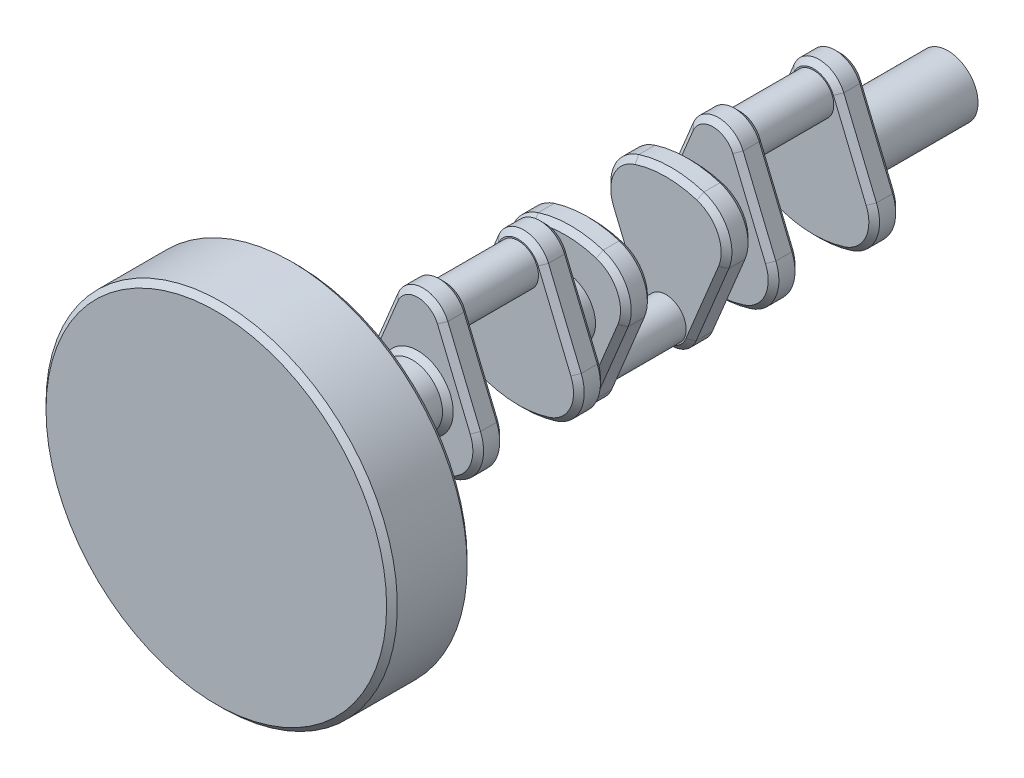
from build123d import *

# Parameters (mm, degrees)
SKETCH1_R             = 9.525
BOSS_EXTRUDE1_DEPTH   = 34.925
BOSS_EXTRUDE2_DEPTH   = 12.7
FILLET1_R             = 19.05
SKETCH3_R             = 14.2875
BOSS_EXTRUDE3_DEPTH   = 9.525
LPATTERN1_COUNT       = 3
LPATTERN1_PITCH       = 69.85
BODY_MOVE_COPY1_ANGLE = 180
LPATTERN2_COUNT       = 2
LPATTERN2_PITCH       = 69.85
SKETCH4_R             = 14.2875
BOSS_EXTRUDE4_DEPTH   = 57.15
BOSS_EXTRUDE5_START   = 50.8
SKETCH5_R             = 14.2875
BOSS_EXTRUDE5_DEPTH   = 50.8
SKETCH6_R             = 83.107085054
BOSS_EXTRUDE6_DEPTH   = 38.1
CHAMFER1_SIZE         = 2.54


with BuildPart() as part:
    # Sketch1 → Boss-Extrude1 (new body)
    with BuildSketch(Plane.XY):
        Circle(SKETCH1_R)
    extrude(amount=-BOSS_EXTRUDE1_DEPTH)

    # Sketch2 → Boss-Extrude2 (add)
    with BuildSketch(Plane(origin=(0, 0, -34.925), x_dir=(-1, 0, 0), z_dir=(0, 0, -1))):
        with BuildLine():
            Line((-11.733270063, 4.860079591), (-33.507418174, -47.707364088))
            ThreePointArc((-33.507418174, -47.707364088), (0, -60.325), (33.507418174, -47.707364088))
            Line((33.507418174, -47.707364088), (11.733270063, 4.860079591))
            ThreePointArc((11.733270063, 4.860079591), (0, 12.7), (-11.733270063, 4.860079591))
        make_face()
    extrude(amount=BOSS_EXTRUDE2_DEPTH)

    # Fillet1
    fillet1_edges = [part.edges().sort_by_distance(p)[0] for p in [
        (33.507418174, -47.707364088, -41.275),
        (-33.507418174, -47.707364088, -41.275),
    ]]
    fillet(fillet1_edges, radius=FILLET1_R)

    # Mirror2: part across plane


with BuildPart() as part_1:
    add(part.part)
    add(part.part.mirror(Plane.XY.offset(-17.4625)))


with BuildPart() as body_2:
    # Sketch3 → Boss-Extrude3 (new body)
    with BuildSketch(Plane(origin=(0, 0, -47.625), x_dir=(-1, 0, 0), z_dir=(0, 0, -1))):
        with Locations((0, -28.486474017)):
            Circle(SKETCH3_R)
    boss_extrude3 = extrude(amount=BOSS_EXTRUDE3_DEPTH)


with BuildPart() as lpattern1_1:
    # LPattern1: pattern copy
    add(part_1.part.moved(Location(Vector(0, 0, -1) * (1 * LPATTERN1_PITCH))))


with BuildPart() as lpattern1_2:
    # LPattern1: pattern copy
    add(part_1.part.moved(Location(Vector(0, 0, -1) * (2 * LPATTERN1_PITCH))))

    # Sketch5 → Boss-Extrude5 (add)
    with BuildSketch(Plane(origin=(0, 0, -187.325), x_dir=(-1, 0, 0), z_dir=(0, 0, -1)).offset(BOSS_EXTRUDE5_START)):
        with Locations((0, -28.486474017)):
            Circle(SKETCH5_R)
    extrude(amount=-BOSS_EXTRUDE5_DEPTH)


with BuildPart() as lpattern1_1_1:
    # Body-Move/Copy1: moved
    add(lpattern1_1.part.rotate(Axis((0, -28.486474017, 0), (0, 0, 1)), BODY_MOVE_COPY1_ANGLE))


with BuildPart() as lpattern2_1:
    # LPattern2: Boss-Extrude3 ×2
    with Locations(*[(0, 0, -i * LPATTERN2_PITCH) for i in range(1, LPATTERN2_COUNT)]):
        add(boss_extrude3)


with BuildPart() as part_2:
    add(part_1.part)

    # Sketch4 → Boss-Extrude4 (add)
    with BuildSketch(Plane.XY.offset(12.7)):
        with Locations((0, -28.486474017)):
            Circle(SKETCH4_R)
    extrude(amount=BOSS_EXTRUDE4_DEPTH)

    # Sketch6 → Boss-Extrude6 (add)
    with BuildSketch(Plane.XY.offset(69.85)):
        with Locations((0, -28.486474017)):
            Circle(SKETCH6_R)
    extrude(amount=BOSS_EXTRUDE6_DEPTH)


with BuildPart() as body_2_1:
    add(body_2.part)

    # Combine1: union LPattern1_1, LPattern2_1, LPattern1_2, part
    add(lpattern1_1_1.part)
    add(lpattern2_1.part)
    add(lpattern1_2.part)
    add(part_2.part)

    # Chamfer1
    chamfer1_edges = [body_2_1.edges().sort_by_distance(p)[0] for p in [
        (14.2875, -28.486474017, -187.325),
        (-14.2875, -28.486474017, 12.7),
        (-26.88006293, -47.820548612, -174.625),
        (-19.470080331, -13.818232688, -174.625),
        (0, -60.325, -174.625),
        (0, 12.7, -174.625),
        (26.88006293, -47.820548612, -174.625),
        (19.470080331, -13.818232688, -174.625),
        (-26.88006293, -47.820548612, -187.325),
        (-19.470080331, -13.818232688, -187.325),
        (0, -60.325, -187.325),
        (0, 12.7, -187.325),
        (26.88006293, -47.820548612, -187.325),
        (19.470080331, -13.818232688, -187.325),
        (-26.88006293, -47.820548612, -139.7),
        (-19.470080331, -13.818232688, -139.7),
        (0, -60.325, -139.7),
        (0, 12.7, -139.7),
        (26.88006293, -47.820548612, -139.7),
        (19.470080331, -13.818232688, -139.7),
        (-26.88006293, -47.820548612, -127),
        (-19.470080331, -13.818232688, -127),
        (0, -60.325, -127),
        (0, 12.7, -127),
        (26.88006293, -47.820548612, -127),
        (19.470080331, -13.818232688, -127),
        (-19.470080331, -43.154715345, -117.475),
        (-26.88006293, -9.152399421, -117.475),
        (0, -69.672948033, -117.475),
        (0, 3.352051967, -117.475),
        (19.470080331, -43.154715345, -117.475),
        (26.88006293, -9.152399421, -117.475),
        (-19.470080331, -43.154715345, -104.775),
        (0, -69.672948033, -104.775),
        (-26.88006293, -9.152399421, -104.775),
        (19.470080331, -43.154715345, -104.775),
        (0, 3.352051967, -104.775),
        (26.88006293, -9.152399421, -104.775),
        (-19.470080331, -43.154715345, -69.85),
        (0, -69.672948033, -69.85),
        (-26.88006293, -9.152399421, -69.85),
        (19.470080331, -43.154715345, -69.85),
        (0, 3.352051967, -69.85),
        (26.88006293, -9.152399421, -69.85),
        (-19.470080331, -43.154715345, -57.15),
        (-26.88006293, -9.152399421, -57.15),
        (0, -69.672948033, -57.15),
        (0, 3.352051967, -57.15),
        (19.470080331, -43.154715345, -57.15),
        (26.88006293, -9.152399421, -57.15),
        (-19.470080331, -13.818232688, -47.625),
        (0, 12.7, -47.625),
        (-26.88006293, -47.820548612, -47.625),
        (19.470080331, -13.818232688, -47.625),
        (0, -60.325, -47.625),
        (26.88006293, -47.820548612, -47.625),
        (-19.470080331, -13.818232688, -34.925),
        (-26.88006293, -47.820548612, -34.925),
        (0, 12.7, -34.925),
        (0, -60.325, -34.925),
        (19.470080331, -13.818232688, -34.925),
        (26.88006293, -47.820548612, -34.925),
        (-19.470080331, -13.818232688, 0),
        (-26.88006293, -47.820548612, 0),
        (0, 12.7, 0),
        (0, -60.325, 0),
        (19.470080331, -13.818232688, 0),
        (26.88006293, -47.820548612, 0),
        (-19.470080331, -13.818232688, 12.7),
        (0, 12.7, 12.7),
        (-26.88006293, -47.820548612, 12.7),
        (19.470080331, -13.818232688, 12.7),
        (0, -60.325, 12.7),
        (26.88006293, -47.820548612, 12.7),
        (-83.107085054, -28.486474017, 69.85),
        (-83.107085054, -28.486474017, 107.95),
    ]]
    chamfer(chamfer1_edges, length=CHAMFER1_SIZE)


solid = body_2_1.part
